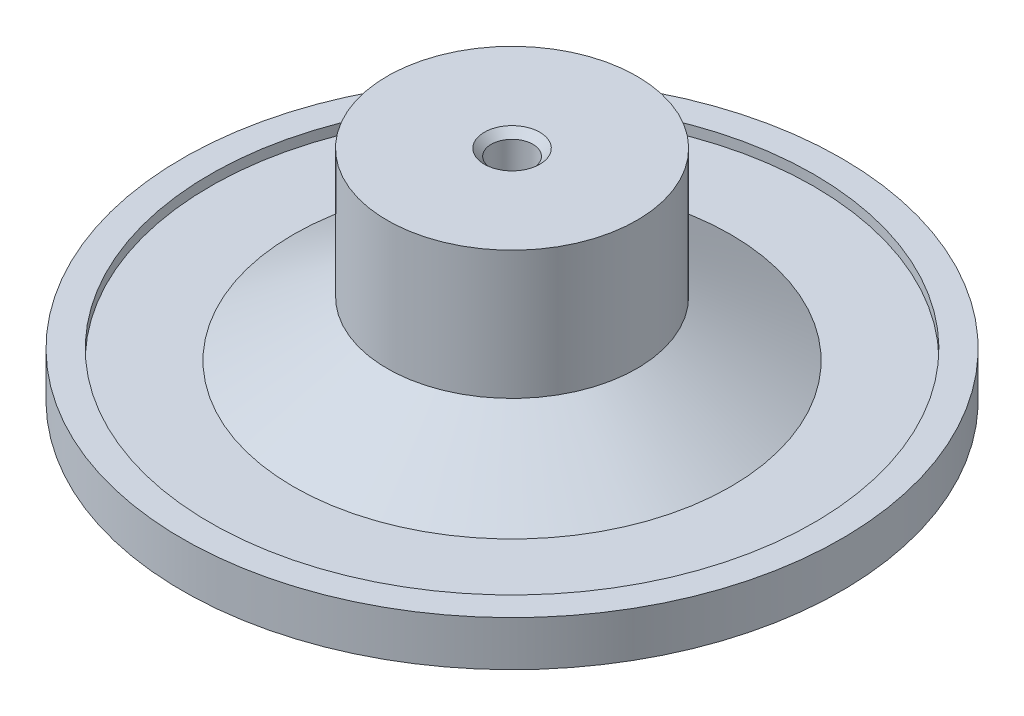
from build123d import *


with BuildPart() as part:
    # Sketch1 → Revolve2 (revolve)
    with BuildSketch(Plane.XY, mode=Mode.PRIVATE) as revolve2_sk:
        Polygon((435, -55), (475, -55), (475, 10), (435, 10), (435, -5), (315, -5), (180, 75), (180, 260), (40, 260), (30, 250), (30, 0), (225, 0), (335, -40), (435, -40), align=None)
    revolve(revolve2_sk.sketch.rotate(Axis((0, 0, 0), (0, 1, 0)), 90), axis=Axis((0, 0, 0), (0, 1, 0)))


solid = part.part
